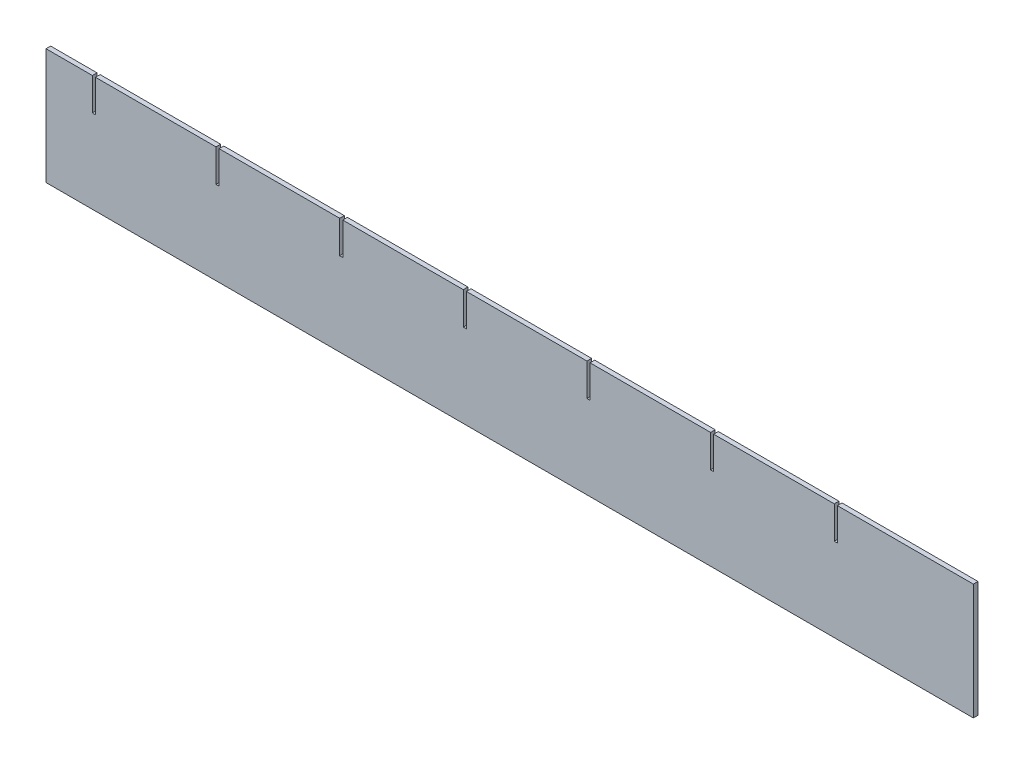
from build123d import *

# Parameters (mm, degrees)
BOSS_EXTRUDE1_DEPTH = 3


with BuildPart() as part:
    # Sketch1 → Boss-Extrude1 (new body)
    with BuildSketch(Plane.XY):
        Polygon((-190, 37.5), (-268, 37.5), (-268, 16.5), (-270, 16.5), (-270, 37.5), (-300, 37.5), (-300, -37.5), (300, -37.5), (300, 37.5), (212, 37.5), (212, 16.5), (210, 16.5), (210, 37.5), (132, 37.5), (132, 16.5), (130, 16.5), (130, 37.5), (52, 37.5), (52, 16.5), (50, 16.5), (50, 37.5), (-28, 37.5), (-28, 16.5), (-30, 16.5), (-30, 37.5), (-108, 37.5), (-108, 16.5), (-110, 16.5), (-110, 37.5), (-188, 37.5), (-188, 16.5), (-190, 16.5), align=None)
    extrude(amount=BOSS_EXTRUDE1_DEPTH)


solid = part.part
